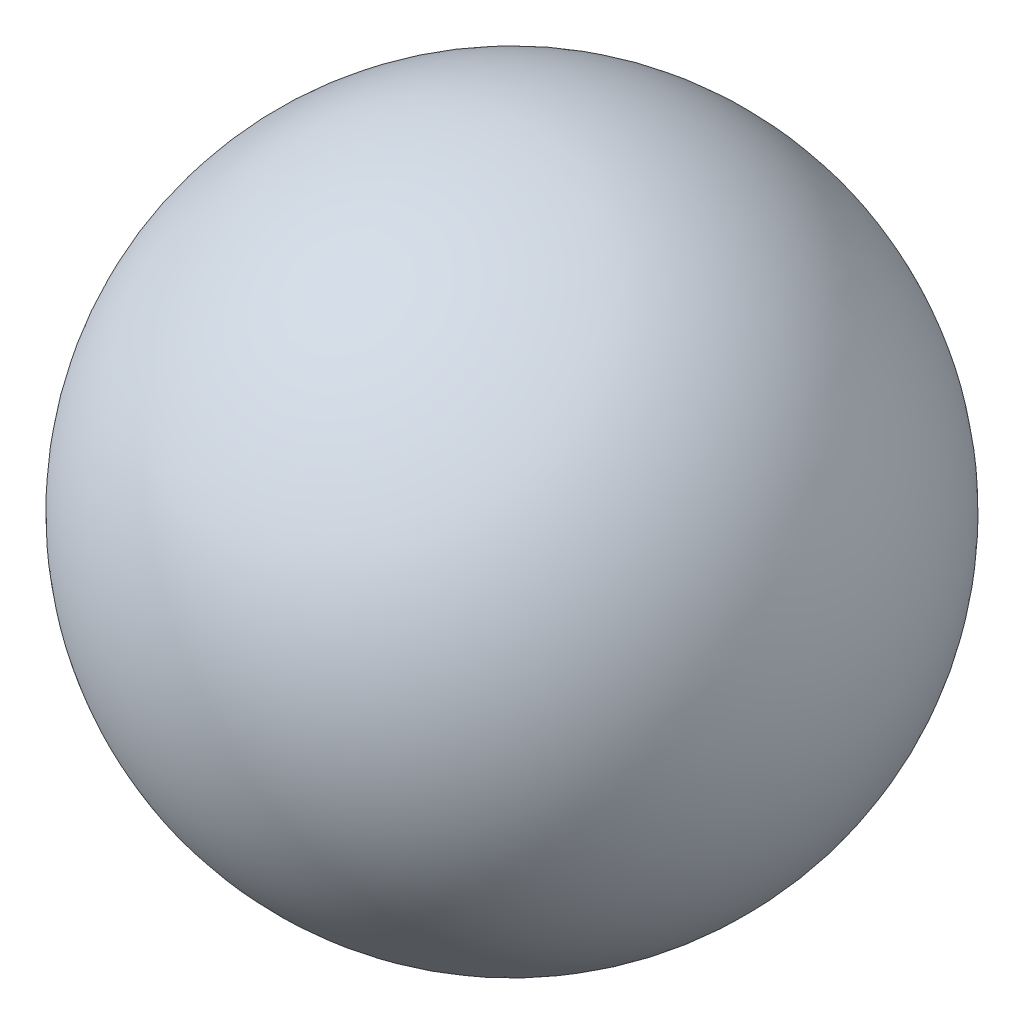
from build123d import *


with BuildPart() as part:
    # Sketch3 → Revolve1 (revolve)
    with BuildSketch(Plane(origin=(0, 0, 0), x_dir=(1, 0, 0), z_dir=(0, 1, 0))):
        with BuildLine():
            Line((0, 117.233531081), (0, -117.233531081))
            ThreePointArc((0, -117.233531081), (117.233531081, 0), (0, 117.233531081))
        make_face()
    revolve(axis=Axis((0, 0, -117.233531081), (0, 0, 1)))


solid = part.part
